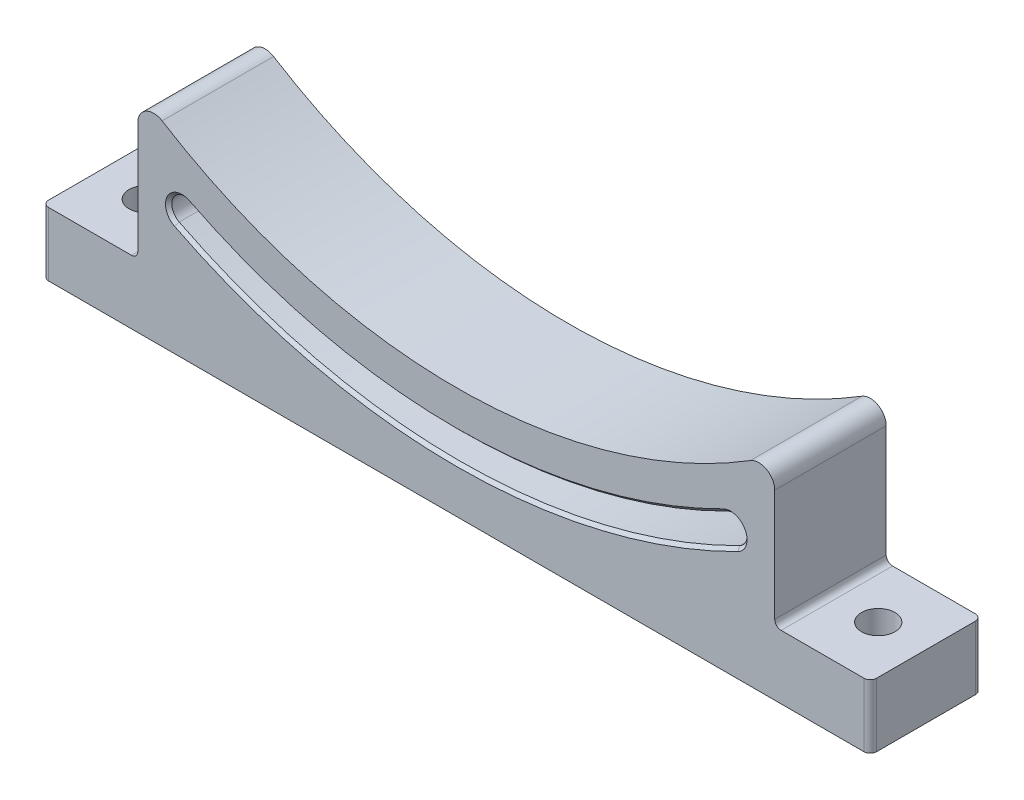
from build123d import *

# Parameters (mm, degrees)
BOSS_EXTRUDE1_DEPTH = 35
FILLET1_R           = 5
CHAMFER1_SIZE       = 1
SKETCH2_W           = 35
SKETCH2_H           = 20
BOSS_EXTRUDE2_DEPTH = 30
FILLET2_R           = 2
SKETCH3_W           = 35
SKETCH3_H           = 20
BOSS_EXTRUDE3_DEPTH = 30
FILLET3_R           = 2
FILLET4_R           = 2
SKETCH4_R           = 5.25
CUT_EXTRUDE1_DEPTH  = 20


with BuildPart() as part:
    # Sketch1 → Boss-Extrude1 (new body)
    with BuildSketch(Plane.XY):
        with BuildLine():
            Line((0, 0), (-200, 0))
            Line((-200, 0), (-200, 66.385933837))
            ThreePointArc((-200, 66.385933837), (-100, 35), (0, 66.385933837))
            Line((0, 66.385933837), (0, 0))
        make_face()
        with BuildLine():
            ThreePointArc((-184.216990788, 43.037433948), (-100, 23), (-15.783009212, 43.037433948))
            ThreePointArc((-15.783009212, 43.037433948), (-10.141543229, 41.178977178), (-12, 35.537511195))
            ThreePointArc((-12, 35.537511195), (-100, 14.6), (-188, 35.537511195))
            ThreePointArc((-188, 35.537511195), (-189.858456771, 41.178977178), (-184.216990788, 43.037433948))
        make_face(mode=Mode.SUBTRACT)
    extrude(amount=BOSS_EXTRUDE1_DEPTH)

    # Fillet1
    fillet1_edges = [part.edges().sort_by_distance(p)[0] for p in [
        (-200, 66.385933837, 17.5),
        (0, 66.385933837, 17.5),
    ]]
    fillet(fillet1_edges, radius=FILLET1_R)

    # Chamfer1
    chamfer1_edges = [part.edges().sort_by_distance(p)[0] for p in [
        (-189.858456771, 41.178977178, 0),
        (-100, 14.6, 0),
        (-10.141543229, 41.178977178, 0),
        (-100, 23, 0),
        (-189.858456771, 41.178977178, 35),
        (-100, 14.6, 35),
        (-10.141543229, 41.178977178, 35),
        (-100, 23, 35),
    ]]
    chamfer(chamfer1_edges, length=CHAMFER1_SIZE)

    # Sketch2 → Boss-Extrude2 (add)
    with BuildSketch(Plane(origin=(0, 0, 0), x_dir=(0, 0, -1), z_dir=(1, 0, 0))):
        with Locations((-17.5, 10)):
            Rectangle(SKETCH2_W, SKETCH2_H)
    extrude(amount=BOSS_EXTRUDE2_DEPTH)

    # Fillet2
    fillet2_edges = [part.edges().sort_by_distance(p)[0] for p in [
        (0, 20, 17.5),
    ]]
    fillet(fillet2_edges, radius=FILLET2_R)

    # Sketch3 → Boss-Extrude3 (add)
    with BuildSketch(Plane.ZY.offset(200)):
        with Locations((17.5, 10)):
            Rectangle(SKETCH3_W, SKETCH3_H)
    extrude(amount=BOSS_EXTRUDE3_DEPTH)

    # Fillet3
    fillet3_edges = [part.edges().sort_by_distance(p)[0] for p in [
        (-200, 20, 17.5),
    ]]
    fillet(fillet3_edges, radius=FILLET3_R)

    # Fillet4
    fillet4_edges = [part.edges().sort_by_distance(p)[0] for p in [
        (30, 10, 35),
        (30, 10, 0),
        (-230, 10, 0),
        (-230, 10, 35),
    ]]
    fillet(fillet4_edges, radius=FILLET4_R)

    # Sketch4 → Cut-Extrude1 (cut)
    with BuildSketch(Plane(origin=(0, 20, 0), x_dir=(1, 0, 0), z_dir=(0, 1, 0))):
        with Locations(Location((-215, -17.5, 0), (0, 0, 270))):
            Circle(SKETCH4_R)
        with Locations(Location((15, -17.5, 0), (0, 0, 270))):
            Circle(SKETCH4_R)
    extrude(amount=-CUT_EXTRUDE1_DEPTH, mode=Mode.SUBTRACT)


solid = part.part
